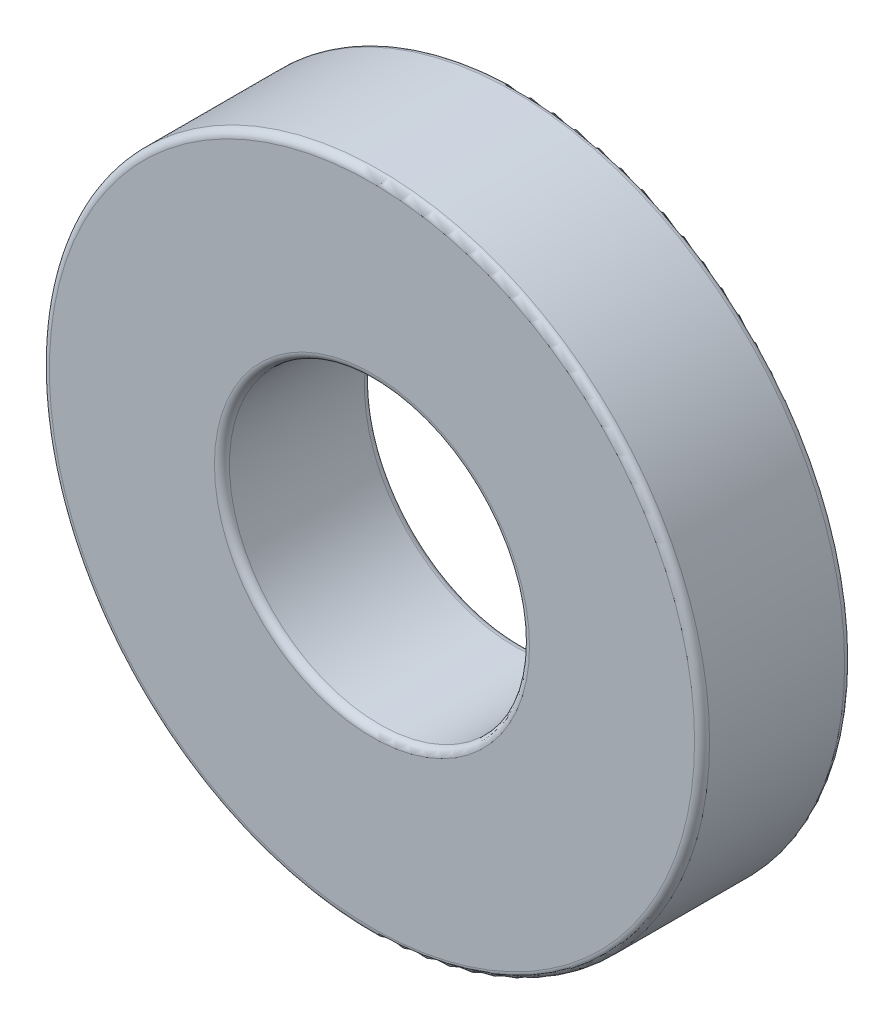
from build123d import *

# Parameters (mm, degrees)
SKETCH1_R           = 2.2
SKETCH1_R_2         = 1
BOSS_EXTRUDE1_DEPTH = 1
FILLET1_R           = 0.05


with BuildPart() as part:
    # Sketch1 → Boss-Extrude1 (new body)
    with BuildSketch(Plane.XY):
        Circle(SKETCH1_R)
        Circle(SKETCH1_R_2, mode=Mode.SUBTRACT)
    extrude(amount=BOSS_EXTRUDE1_DEPTH)

    # Fillet1
    fillet1_edges = [part.edges().sort_by_distance(p)[0] for p in [
        (-2.2, 0, 0),
        (-2.2, 0, 1),
        (-1, 0, 0),
        (-1, 0, 1),
    ]]
    fillet(fillet1_edges, radius=FILLET1_R)


solid = part.part
